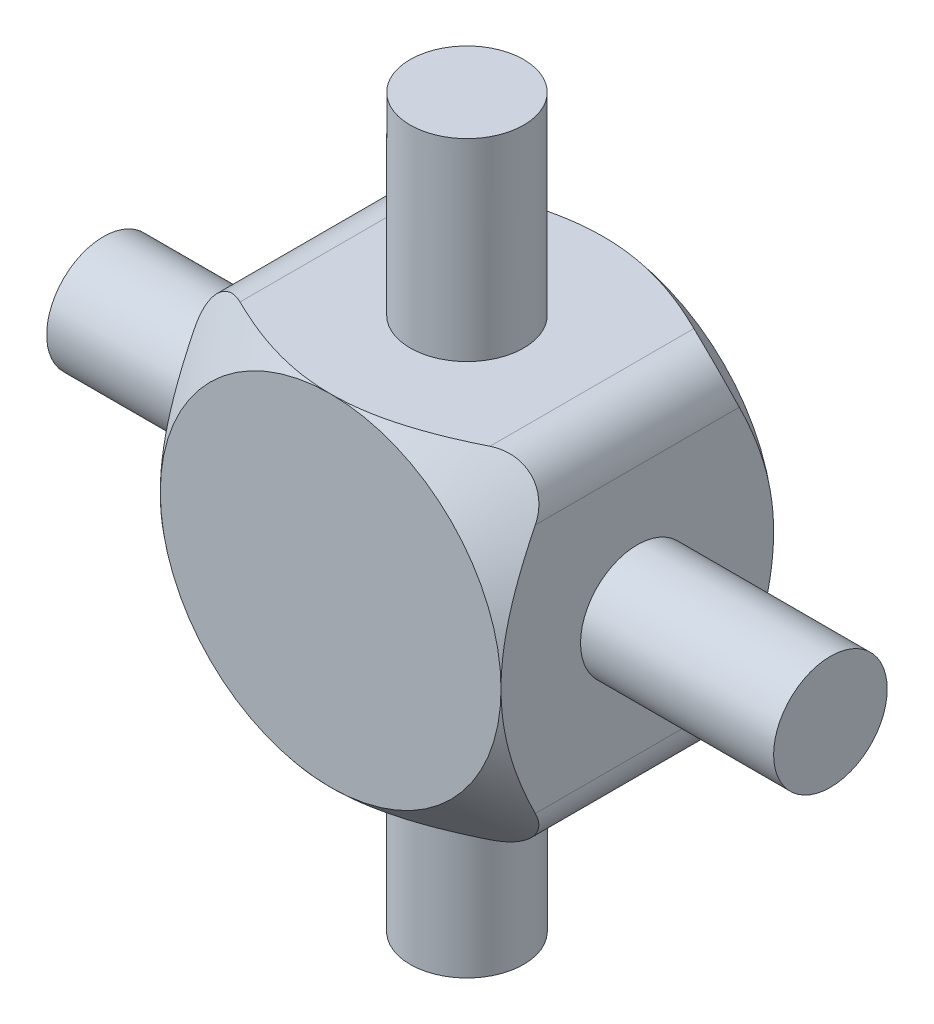
from build123d import *

# Parameters (mm, degrees)
SKETCH1_W           = 15
SKETCH1_H           = 15
BOSS_EXTRUDE1_DEPTH = 12
SKETCH2_OUTSIDE_W   = 69.544
SKETCH2_OUTSIDE_H   = 69.544
SKETCH2_OUTSIDE_R   = 7.5
CUT_EXTRUDE1_DEPTH  = 20
CUT_EXTRUDE1_DRAFT  = -50
SKETCH3_OUTSIDE_W   = 69.544
SKETCH3_OUTSIDE_H   = 69.544
SKETCH3_OUTSIDE_R   = 7.5
CUT_EXTRUDE2_DEPTH  = 20
CUT_EXTRUDE2_DRAFT  = -50
FILLET1_R           = 2
SKETCH5_R           = 2.5
BOSS_EXTRUDE2_DEPTH = 16
SKETCH6_R           = 2.5
BOSS_EXTRUDE3_DEPTH = 16


with BuildPart() as part:
    # Sketch1 → Boss-Extrude1 (new body)
    with BuildSketch(Plane.XY):
        Rectangle(SKETCH1_W, SKETCH1_H)
    extrude(amount=BOSS_EXTRUDE1_DEPTH)


with BuildPart() as cut_extrude1_tool:
    # Sketch2 outside → Cut-Extrude1 (with draft: the straight prism first)
    with BuildSketch(Plane.XY.offset(12)):
        Rectangle(SKETCH2_OUTSIDE_W, SKETCH2_OUTSIDE_H)
        Circle(SKETCH2_OUTSIDE_R, mode=Mode.SUBTRACT)
    extrude(amount=-CUT_EXTRUDE1_DEPTH)
    # Cut-Extrude1: the draft: its side faces are tilted about the plane it starts from
    cut_extrude1_sides = [cut_extrude1_tool.faces().sort_by_distance(p)[0] for p in [
        (0, -34.772, 2),
        (34.772, 0, 2),
        (0, 34.772, 2),
        (-34.772, 0, 2),
        (-7.5, 0, 2),
    ]]
    draft(cut_extrude1_sides, Plane.XY.offset(12), CUT_EXTRUDE1_DRAFT)


with BuildPart() as part_1:
    add(part.part)

    # Cut-Extrude1: cut by cut_extrude1_tool
    add(cut_extrude1_tool.part, mode=Mode.SUBTRACT)


with BuildPart() as cut_extrude2_tool:
    # Sketch3 outside → Cut-Extrude2 (with draft: the straight prism first)
    with BuildSketch(Plane(origin=(0, 0, 0), x_dir=(-1, 0, 0), z_dir=(0, 0, -1))):
        Rectangle(SKETCH3_OUTSIDE_W, SKETCH3_OUTSIDE_H)
        Circle(SKETCH3_OUTSIDE_R, mode=Mode.SUBTRACT)
    extrude(amount=-CUT_EXTRUDE2_DEPTH)
    # Cut-Extrude2: the draft: its side faces are tilted about the plane it starts from
    cut_extrude2_sides = [cut_extrude2_tool.faces().sort_by_distance(p)[0] for p in [
        (0, -34.772, 10),
        (-34.772, 0, 10),
        (0, 34.772, 10),
        (34.772, 0, 10),
        (7.5, 0, 10),
    ]]
    draft(cut_extrude2_sides, Plane(origin=(0, 0, 0), x_dir=(-1, 0, 0), z_dir=(0, 0, -1)), CUT_EXTRUDE2_DRAFT)


with BuildPart() as part_2:
    add(part_1.part)

    # Cut-Extrude2: cut by cut_extrude2_tool
    add(cut_extrude2_tool.part, mode=Mode.SUBTRACT)

    # Fillet1
    fillet1_edges = [part_2.edges().sort_by_distance(p)[0] for p in [
        (7.5, -7.5, 6),
        (7.5, 7.5, 6),
        (-7.5, 7.5, 6),
        (-7.5, -7.5, 6),
    ]]
    fillet(fillet1_edges, radius=FILLET1_R)

    # Sketch5 → Boss-Extrude2 (add, symmetric)
    with BuildSketch(Plane(origin=(0, 0, 0), x_dir=(1, 0, 0), z_dir=(0, 1, 0))):
        with Locations(Location((0, -6, 0), (0, 0, 270))):
            Circle(SKETCH5_R)
    extrude(amount=BOSS_EXTRUDE2_DEPTH, both=True)

    # Sketch6 → Boss-Extrude3 (add, symmetric)
    with BuildSketch(Plane(origin=(0, 0, 0), x_dir=(0, 0, -1), z_dir=(1, 0, 0))):
        with Locations((-6, 0)):
            Circle(SKETCH6_R)
    extrude(amount=BOSS_EXTRUDE3_DEPTH, both=True)


solid = part_2.part
